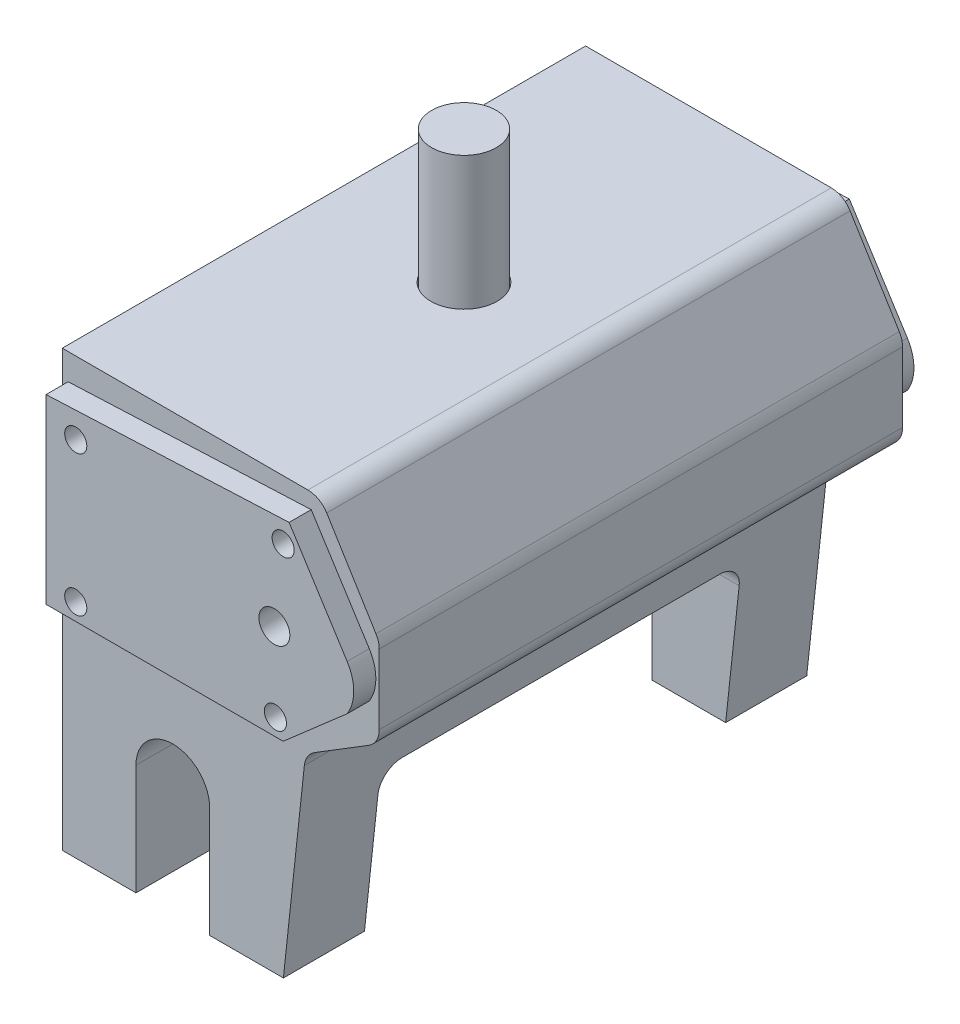
from build123d import *

# Parameters (mm, degrees)
EXTRUDE_1_DEPTH     = 71
CUT_EXTRUDE_2_DEPTH = 71
SKETCH_3_W          = 28.502340284
SKETCH_3_H          = 18.562195974
CUT_EXTRUDE_3_DEPTH = 71
EXTRUDE_4_DEPTH     = 3
SKETCH_5_R          = 1.5
CUT_EXTRUDE_5_DEPTH = 10
SKETCH_6_R          = 4.5
CUT_EXTRUDE_6_DEPTH = 10
SKETCH_8_R          = 2.1
CUT_EXTRUDE_7_DEPTH = 15
SKETCH_9_R          = 2.1
CUT_EXTRUDE_8_DEPTH = 101.617881054


with BuildPart() as part:
    # 草图1 → 拉伸1 (new body)
    with BuildSketch(Plane.XY):
        with BuildLine():
            Line((-32.966640689, -19.89344536), (-32.966640689, 39.10655464))
            Line((-32.966640689, 39.10655464), (0.356973729, 39.10655464))
            ThreePointArc((0.356973729, 39.10655464), (1.820381254, 38.725416686), (2.911948679, 37.678846917))
            Line((2.911948679, 37.678846917), (9.588334261, 26.829720346))
            ThreePointArc((9.588334261, 26.829720346), (9.919959807, 26.074457796), (10.033359311, 25.257428069))
            Line((10.033359311, 25.257428069), (10.033359311, 15.782940222))
            ThreePointArc((10.033359311, 15.782940222), (9.652221357, 14.319532697), (8.605651588, 13.227965272))
            Line((8.605651588, 13.227965272), (1.286230543, 8.723706168))
            ThreePointArc((1.286230543, 8.723706168), (0.321919702, 7.770494191), (-0.124217104, 6.490076126))
            Line((-0.124217104, 6.490076126), (-2.966640689, -19.89344536))
            Line((-2.966640689, -19.89344536), (-12.966640689, -19.89344536))
            Line((-12.966640689, -19.89344536), (-12.966640689, -4.89344536))
            ThreePointArc((-12.966640689, -4.89344536), (-17.966640689, 0.10655464), (-22.966640689, -4.89344536))
            Line((-22.966640689, -4.89344536), (-22.966640689, -19.89344536))
            Line((-22.966640689, -19.89344536), (-32.966640689, -19.89344536))
        make_face()
    extrude(amount=EXTRUDE_1_DEPTH)

    # 草图2 → 拉伸2 (cut)
    with BuildSketch(Plane.ZY.offset(32.966640689)):
        with BuildLine():
            Line((11, -19.89344536), (11, -2.89344536))
            ThreePointArc((11, -2.89344536), (11.878679656, -0.772125016), (14, 0.10655464))
            Line((14, 0.10655464), (57, 0.10655464))
            ThreePointArc((57, 0.10655464), (59.121320344, -0.772125016), (60, -2.89344536))
            Line((60, -2.89344536), (60, -19.89344536))
            Line((60, -19.89344536), (11, -19.89344536))
        make_face()
    extrude(amount=-CUT_EXTRUDE_2_DEPTH, mode=Mode.SUBTRACT)

    # 草图3 → 拉伸3 (cut)
    with BuildSketch(Plane.XY.offset(71)):
        with Locations((-14.251170142, 23.589261476)):
            Rectangle(SKETCH_3_W, SKETCH_3_H)
    extrude(amount=-CUT_EXTRUDE_3_DEPTH, mode=Mode.SUBTRACT)

    # 草图4 → 拉伸4 (add)
    with BuildSketch(Plane.XY.offset(71)):
        with BuildLine():
            Line((-32.165931594, 13.697564937), (-32.165931594, 35.556993091))
            Line((-32.165931594, 35.556993091), (0.806390202, 37.022429615))
            Line((0.806390202, 37.022429615), (8.68311152, 24.627279014))
            ThreePointArc((8.68311152, 24.627279014), (9.577922468, 21.550792247), (8.68311152, 18.47430548))
            Line((8.68311152, 18.47430548), (0, 10.907326517))
            Line((0, 10.907326517), (-32.165931594, 10.907326517))
            Line((-32.165931594, 10.907326517), (-32.165931594, 13.697564937))
        make_face()
    extrude_4 = extrude(amount=EXTRUDE_4_DEPTH)

    # 草图5 → 拉伸5 (cut)
    with BuildSketch(Plane.XY.offset(74)):
        with Locations((-28.135981152, 32.259760911)):
            Circle(SKETCH_5_R)
        with Locations((0, 34.091556567)):
            Circle(SKETCH_5_R)
        with Locations((-1.049162635, 13.209086096)):
            Circle(SKETCH_5_R)
        with Locations((-28.135981152, 13.209086096)):
            Circle(SKETCH_5_R)
    cut_extrude_5 = extrude(amount=-CUT_EXTRUDE_5_DEPTH, mode=Mode.SUBTRACT)

    # 镜向2: 拉伸4, 拉伸5 across plane
    add(extrude_4.mirror(Plane(origin=(0, 0, 36), x_dir=(1, 0, 0), z_dir=(0, 0, -1))))
    add(cut_extrude_5.mirror(Plane(origin=(0, 0, 36), x_dir=(1, 0, 0), z_dir=(0, 0, -1))), mode=Mode.SUBTRACT)

    # 草图6 → 拉伸6 (cut)
    with BuildSketch(Plane(origin=(0, 39.10655464, 0), x_dir=(1, 0, 0), z_dir=(0, 1, 0))):
        with Locations(Location((-13.466640689, -36, 0), (0, 0, 180))):
            Circle(SKETCH_6_R)
    extrude(amount=-CUT_EXTRUDE_6_DEPTH, mode=Mode.SUBTRACT)

    # 草图7 → 旋转1 (revolve)
    with BuildSketch(Plane(origin=(0, 0, 36), x_dir=(-1, 0, 0), z_dir=(0, 0, -1))):
        Polygon((17.851883619, 32.870359463), (25.473752014, 32.870359463), (25.473752014, 16.752081431), (13.466640689, 16.752081431), (13.466640689, 57.10655464), (17.851883619, 57.10655464), align=None)
    revolve(axis=Axis((-13.466640689, 60.856315585, 36), (0, -1, 0)))

    # 草图8 → 拉伸7 (cut)
    with BuildSketch(Plane.XZ.offset(19.89344536)):
        with Locations(Location((-27.966640689, 65.5, 0), (0, 0, 270))):
            Circle(SKETCH_8_R)
        with Locations(Location((-7.966640689, 66, 0), (0, 0, 270))):
            Circle(SKETCH_8_R)
        with Locations(Location((-27.966640689, 6, 0), (0, 0, 270))):
            Circle(SKETCH_8_R)
        with Locations(Location((-7.966640689, 6, 0), (0, 0, 270))):
            Circle(SKETCH_8_R)
    extrude(amount=-CUT_EXTRUDE_7_DEPTH, mode=Mode.SUBTRACT)

    # 草图9 → 拉伸8 (cut, through all)
    with BuildSketch(Plane(origin=(0, 0, -2), x_dir=(-1, 0, 0), z_dir=(0, 0, -1))):
        with Locations((1.189151156, 23.791556567)):
            Circle(SKETCH_9_R)
    extrude(amount=-CUT_EXTRUDE_8_DEPTH, mode=Mode.SUBTRACT)


solid = part.part
